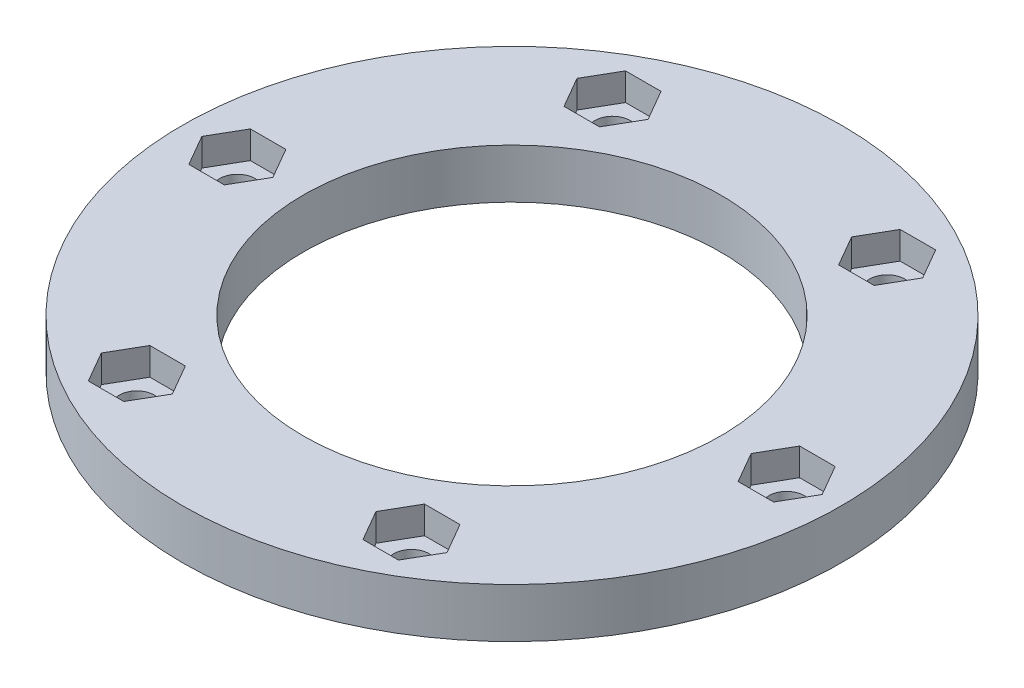
from build123d import *

# Parameters (mm, degrees)
SKETCH1_R           = 30
SKETCH1_R_2         = 19
SKETCH1_R_3         = 1.6
BOSS_EXTRUDE1_DEPTH = 2
SKETCH2_R           = 30
SKETCH2_R_2         = 19
BOSS_EXTRUDE2_DEPTH = 2.5


with BuildPart() as part:
    # Sketch1 → Boss-Extrude1 (new body)
    with BuildSketch(Plane(origin=(0, 0, 0), x_dir=(1, 0, 0), z_dir=(0, 1, 0))):
        with Locations(Location((0, 0, 0), (0, 0, 270))):
            Circle(SKETCH1_R)
        with Locations(Location((0, 0, 0), (0, 0, 270))):
            Circle(SKETCH1_R_2, mode=Mode.SUBTRACT)
        with Locations(Location((25, 0, 0), (0, 0, 270))):
            Circle(SKETCH1_R_3, mode=Mode.SUBTRACT)
        with Locations(Location((12.5, -21.650635095, 0), (0, 0, 270))):
            Circle(SKETCH1_R_3, mode=Mode.SUBTRACT)
        with Locations(Location((-12.5, -21.650635095, 0), (0, 0, 270))):
            Circle(SKETCH1_R_3, mode=Mode.SUBTRACT)
        with Locations(Location((-25, 0, 0), (0, 0, 270))):
            Circle(SKETCH1_R_3, mode=Mode.SUBTRACT)
        with Locations(Location((-12.5, 21.650635095, 0), (0, 0, 270))):
            Circle(SKETCH1_R_3, mode=Mode.SUBTRACT)
        with Locations(Location((12.5, 21.650635095, 0), (0, 0, 270))):
            Circle(SKETCH1_R_3, mode=Mode.SUBTRACT)
    extrude(amount=BOSS_EXTRUDE1_DEPTH)

    # Sketch2 → Boss-Extrude2 (add)
    with BuildSketch(Plane(origin=(0, 2, 0), x_dir=(1, 0, 0), z_dir=(0, 1, 0))):
        with Locations(Location((0, 0, 0), (0, 0, 270))):
            Circle(SKETCH2_R)
        with Locations(Location((0, 0, 0), (0, 0, 270))):
            Circle(SKETCH2_R_2, mode=Mode.SUBTRACT)
        Polygon((15.733161507, -21.650635095), (14.116580754, -18.850635095), (10.883419246, -18.850635095), (9.266838493, -21.650635095), (10.883419246, -24.450635095), (14.116580754, -24.450635095), align=None, mode=Mode.SUBTRACT)
        Polygon((26.616580754, -2.8), (28.233161507, 0), (26.616580754, 2.8), (23.383419246, 2.8), (21.766838493, 0), (23.383419246, -2.8), align=None, mode=Mode.SUBTRACT)
        Polygon((-10.883419246, -24.450635095), (-9.266838493, -21.650635095), (-10.883419246, -18.850635095), (-14.116580754, -18.850635095), (-15.733161507, -21.650635095), (-14.116580754, -24.450635095), align=None, mode=Mode.SUBTRACT)
        Polygon((-26.616580754, -2.8), (-23.383419246, -2.8), (-21.766838493, 0), (-23.383419246, 2.8), (-26.616580754, 2.8), (-28.233161507, 0), align=None, mode=Mode.SUBTRACT)
        Polygon((-15.733161507, 21.650635095), (-14.116580754, 18.850635095), (-10.883419246, 18.850635095), (-9.266838493, 21.650635095), (-10.883419246, 24.450635095), (-14.116580754, 24.450635095), align=None, mode=Mode.SUBTRACT)
        Polygon((10.883419246, 24.450635095), (9.266838493, 21.650635095), (10.883419246, 18.850635095), (14.116580754, 18.850635095), (15.733161507, 21.650635095), (14.116580754, 24.450635095), align=None, mode=Mode.SUBTRACT)
    extrude(amount=BOSS_EXTRUDE2_DEPTH)


solid = part.part
